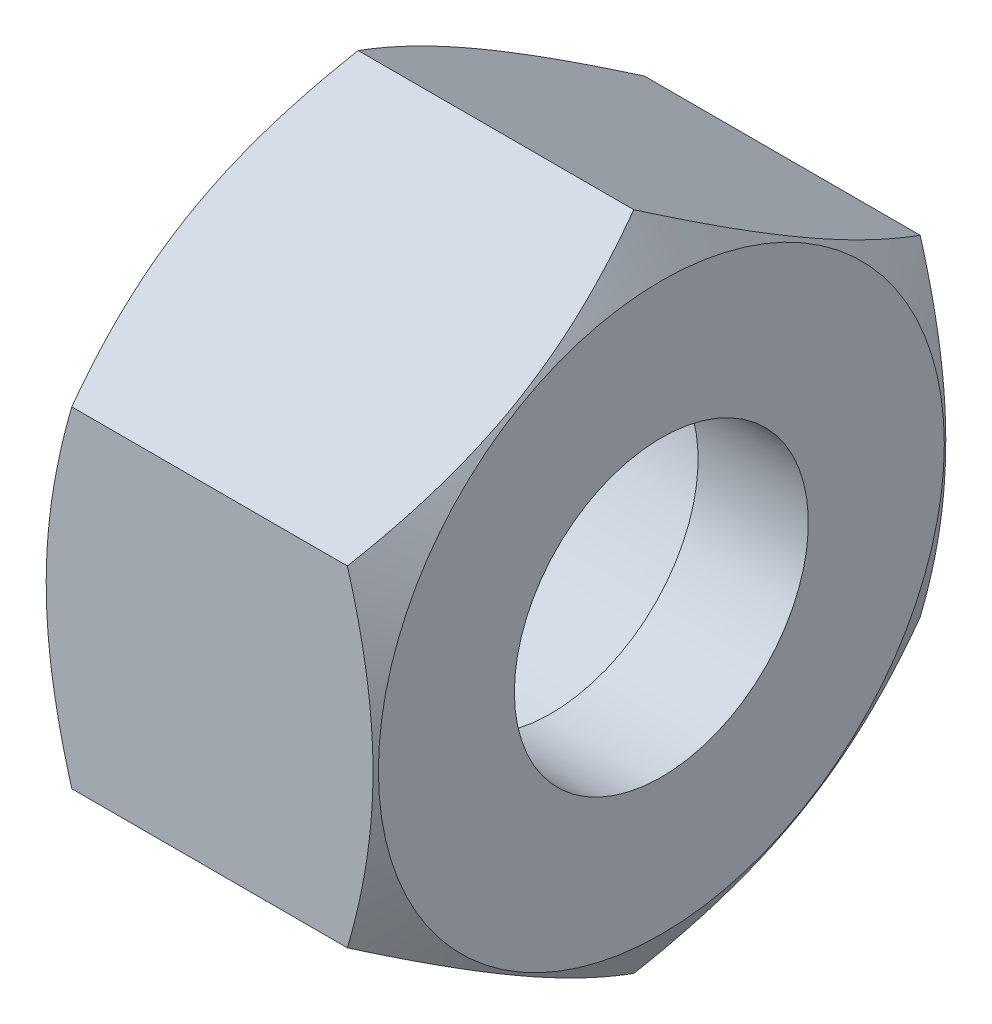
from build123d import *

# Parameters (mm, degrees)
SKETCH_2_OUTSIDE_W  = 48.8
SKETCH_2_OUTSIDE_H  = 48.8
CUT_EXTRUDE_1_DEPTH = 30


with BuildPart() as part:
    # Эскиз1 → Повернуть1 (revolve)
    with BuildSketch(Plane.XY, mode=Mode.PRIVATE) as revolve_1_sk:
        Polygon((18, 12), (18, 15.401923789), (16.5, 18), (1.5, 18), (0, 15.401923789), (0, 12), (10, 12), (10, 13), (12, 13), (12, 8), (18, 8), align=None)
    revolve(revolve_1_sk.sketch.rotate(Axis((0, 0, 0), (1, 0, 0)), 90), axis=Axis((0, 0, 0), (1, 0, 0)))

    # Эскиз2 outside → Вырез-Вытянуть1 (cut)
    with BuildSketch(Plane(origin=(18, 0, 0), x_dir=(0, 0, -1), z_dir=(1, 0, 0))):
        Rectangle(SKETCH_2_OUTSIDE_W, SKETCH_2_OUTSIDE_H)
        Polygon((0, 18), (-15.588457268, 9), (-15.588457268, -9), (0, -18), (15.588457268, -9), (15.588457268, 9), align=None, mode=Mode.SUBTRACT)
    extrude(amount=-CUT_EXTRUDE_1_DEPTH, mode=Mode.SUBTRACT)


solid = part.part
